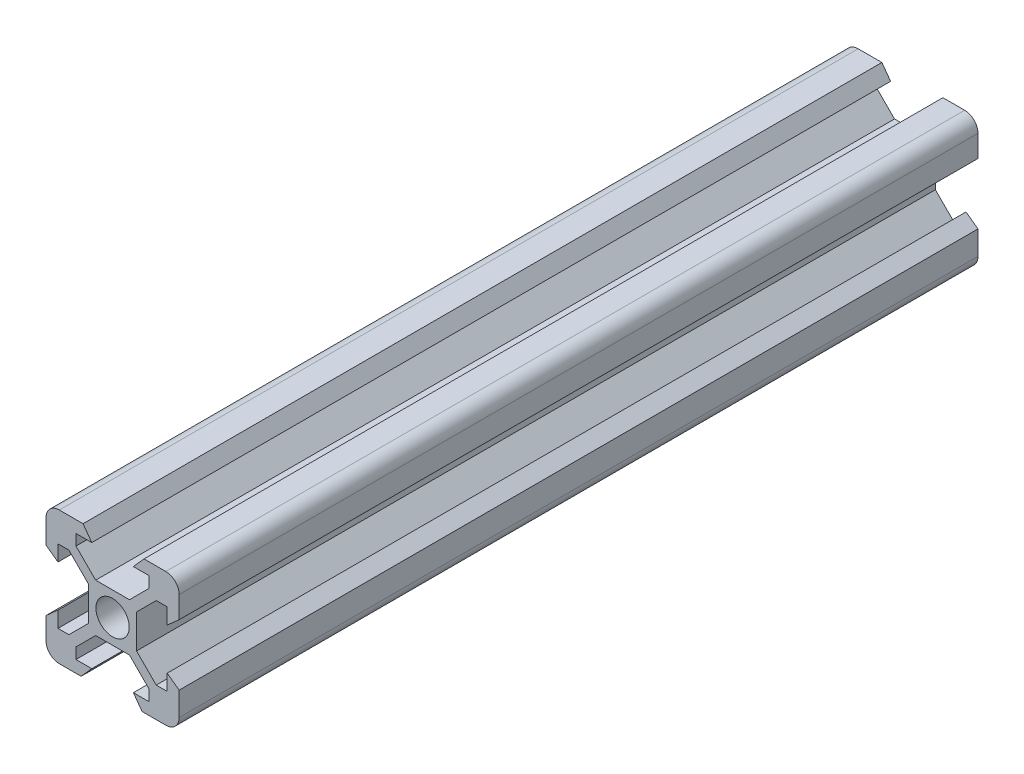
from build123d import *

# Parameters (mm, degrees)
SKETCH1_R               = 2.5
ALUMINIUM_PROFILE_DEPTH = 120


with BuildPart() as part:
    # Sketch1 → Aluminium_profile (new body)
    with BuildSketch(Plane.XY):
        with BuildLine():
            Line((-4.725542729, -10), (-3.125, -8.2))
            Line((-3.125, -8.2), (-5.5, -8.2))
            Line((-5.5, -8.2), (-5.5, -6.560660172))
            Line((-5.5, -6.560660172), (-2.539339828, -3.6))
            Line((-2.539339828, -3.6), (2.539339828, -3.6))
            Line((2.539339828, -3.6), (5.5, -6.560660172))
            Line((5.5, -6.560660172), (5.5, -8.2))
            Line((5.5, -8.2), (3.125, -8.2))
            Line((3.125, -8.2), (4.434457271, -10))
            Line((4.434457271, -10), (8, -10))
            ThreePointArc((8, -10), (9.414213562, -9.414213562), (10, -8))
            Line((10, -8), (10, -4.434457271))
            Line((10, -4.434457271), (8.2, -3.125))
            Line((8.2, -3.125), (8.2, -5.5))
            Line((8.2, -5.5), (6.560660172, -5.5))
            Line((6.560660172, -5.5), (3.6, -2.539339828))
            Line((3.6, -2.539339828), (3.6, 2.539339828))
            Line((3.6, 2.539339828), (6.560660172, 5.5))
            Line((6.560660172, 5.5), (8.2, 5.5))
            Line((8.2, 5.5), (8.2, 3.125))
            Line((8.2, 3.125), (10, 4.725542729))
            Line((10, 4.725542729), (10, 8))
            ThreePointArc((10, 8), (9.414213562, 9.414213562), (8, 10))
            Line((8, 10), (4.725542729, 10))
            Line((4.725542729, 10), (3.125, 8.2))
            Line((3.125, 8.2), (5.5, 8.2))
            Line((5.5, 8.2), (5.5, 6.560660172))
            Line((5.5, 6.560660172), (2.539339828, 3.6))
            Line((2.539339828, 3.6), (-2.539339828, 3.6))
            Line((-2.539339828, 3.6), (-5.5, 6.560660172))
            Line((-5.5, 6.560660172), (-5.5, 8.2))
            Line((-5.5, 8.2), (-3.125, 8.2))
            Line((-3.125, 8.2), (-4.434457271, 10))
            Line((-4.434457271, 10), (-8, 10))
            ThreePointArc((-8, 10), (-9.414213562, 9.414213562), (-10, 8))
            Line((-10, 8), (-10, 4.434457271))
            Line((-10, 4.434457271), (-8.2, 3.125))
            Line((-8.2, 3.125), (-8.2, 5.5))
            Line((-8.2, 5.5), (-6.560660172, 5.5))
            Line((-6.560660172, 5.5), (-3.6, 2.539339828))
            Line((-3.6, 2.539339828), (-3.6, -2.539339828))
            Line((-3.6, -2.539339828), (-6.560660172, -5.5))
            Line((-6.560660172, -5.5), (-8.2, -5.5))
            Line((-8.2, -5.5), (-8.2, -3.125))
            Line((-8.2, -3.125), (-10, -4.725542729))
            Line((-10, -4.725542729), (-10, -8))
            ThreePointArc((-10, -8), (-9.414213562, -9.414213562), (-8, -10))
            Line((-8, -10), (-4.725542729, -10))
        make_face()
        Circle(SKETCH1_R, mode=Mode.SUBTRACT)
    extrude(amount=ALUMINIUM_PROFILE_DEPTH)


solid = part.part
